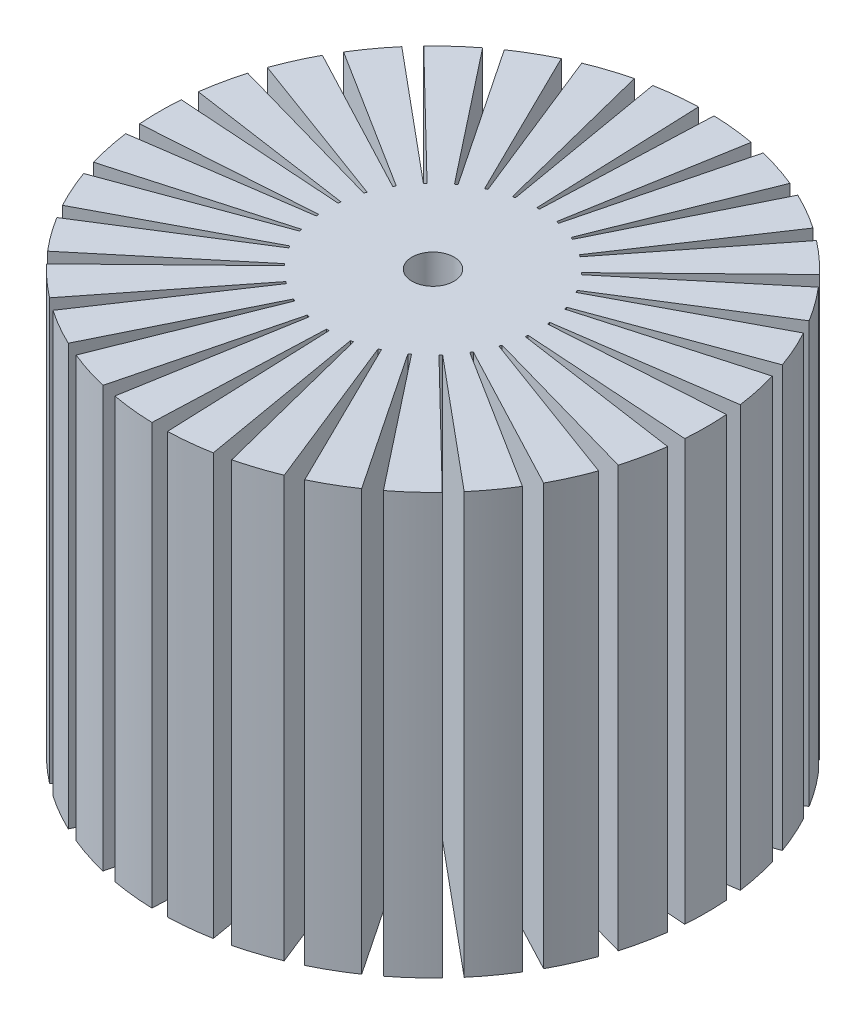
from build123d import *

# Parameters (mm, degrees)
SKETCH1_R               = 32.5
BOSS_EXTRUDE1_DEPTH     = 50
CUT_EXTRUDE1_DEPTH      = 68.915388536
CIRPATTERN1_COUNT       = 30
CUT_EXTRUDE2_DEPTH      = 68.909114756
CUT_EXTRUDE2_DEPTH_BACK = 68.909114756
SKETCH3_R               = 2.5


with BuildPart() as part:
    # Sketch1 → Boss-Extrude1 (new body)
    with BuildSketch(Plane(origin=(0, 0, 0), x_dir=(1, 0, 0), z_dir=(0, 1, 0))):
        with Locations(Location((0, 0, 0), (0, 0, 270))):
            Circle(SKETCH1_R)
    extrude(amount=BOSS_EXTRUDE1_DEPTH)

    # Sketch2 → Cut-Extrude1 (cut, symmetric)
    with BuildSketch(Plane(origin=(0, 50, 0), x_dir=(1, 0, 0), z_dir=(0, 1, 0))):
        Polygon((-6.928301674, 188.527455376), (-0.923110544, 32.486887615), (-0.153919032, 12.5), (0.153919032, 12.5), (0.923110544, 32.486887615), (6.928301674, 188.527455376), (6.928301674, 500.839614011), (-6.928301674, 500.839614011), align=None)
    cut_extrude1 = extrude(amount=CUT_EXTRUDE1_DEPTH, both=True, mode=Mode.SUBTRACT)

    # CirPattern1: Cut-Extrude1 ×30 about axis
    cirpattern1_axis = Axis((0, 50, 0), (0, 1, 0))
    for i in range(1, CIRPATTERN1_COUNT):
        add(cut_extrude1.rotate(cirpattern1_axis, i * 360 / CIRPATTERN1_COUNT), mode=Mode.SUBTRACT)

    # Sketch3 → Cut-Extrude2 (cut, two sides: drawn at the far end of the back side and taken through both)
    with BuildSketch(Plane(origin=(0, 50, 0), x_dir=(1, 0, 0), z_dir=(0, 1, 0)).offset(-CUT_EXTRUDE2_DEPTH_BACK)):
        with Locations(Location((0, 0, 0), (0, 0, 270))):
            Circle(SKETCH3_R)
    extrude(amount=CUT_EXTRUDE2_DEPTH + CUT_EXTRUDE2_DEPTH_BACK, mode=Mode.SUBTRACT)


solid = part.part
